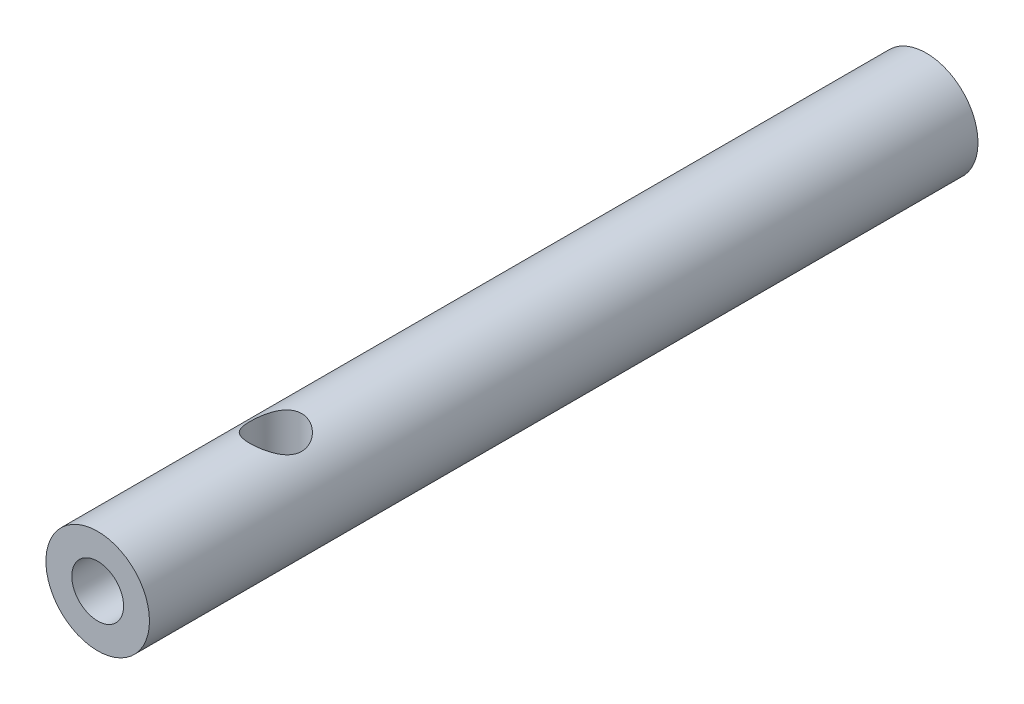
from build123d import *

# Parameters (mm, degrees)
SKETCH1_R               = 6.35
BOSS_EXTRUDE1_DEPTH     = 101.6
SKETCH7_R               = 3.175
CUT_EXTRUDE4_DEPTH      = 12.7
CUT_EXTRUDE5_DEPTH      = 7.62
CUT_EXTRUDE5_DEPTH_BACK = 8.636
SKETCH10_R              = 3.175
CUT_EXTRUDE6_START      = -12.7
SKETCH11_R              = 3.175
CUT_EXTRUDE6_DEPTH      = 12.7


with BuildPart() as part:
    # Sketch1 → Boss-Extrude1 (new body)
    with BuildSketch(Plane.XY):
        Circle(SKETCH1_R)
    extrude(amount=-BOSS_EXTRUDE1_DEPTH)

    # Sketch7 → Cut-Extrude4 (cut)
    with BuildSketch(Plane(origin=(0, 0, -101.6), x_dir=(-1, 0, 0), z_dir=(0, 0, -1))):
        Circle(SKETCH7_R)
    extrude(amount=-CUT_EXTRUDE4_DEPTH, mode=Mode.SUBTRACT)

    # Sketch10 → Cut-Extrude5 (cut, two sides: drawn at the far end of the back side and taken through both)
    with BuildSketch(Plane(origin=(0, 0, 0), x_dir=(1, 0, 0), z_dir=(0, 1, 0)).offset(-CUT_EXTRUDE5_DEPTH_BACK)):
        with Locations(Location((0, 21.844, 0), (0, 0, 90))):
            Circle(SKETCH10_R)
    extrude(amount=CUT_EXTRUDE5_DEPTH + CUT_EXTRUDE5_DEPTH_BACK, mode=Mode.SUBTRACT)

    # Sketch11 → Cut-Extrude6 (cut)
    with BuildSketch(Plane.XY.offset(CUT_EXTRUDE6_START)):
        with Locations(Location((0, 0, 0), (0, 0, 180))):
            Circle(SKETCH11_R)
    extrude(amount=CUT_EXTRUDE6_DEPTH, mode=Mode.SUBTRACT)


solid = part.part
